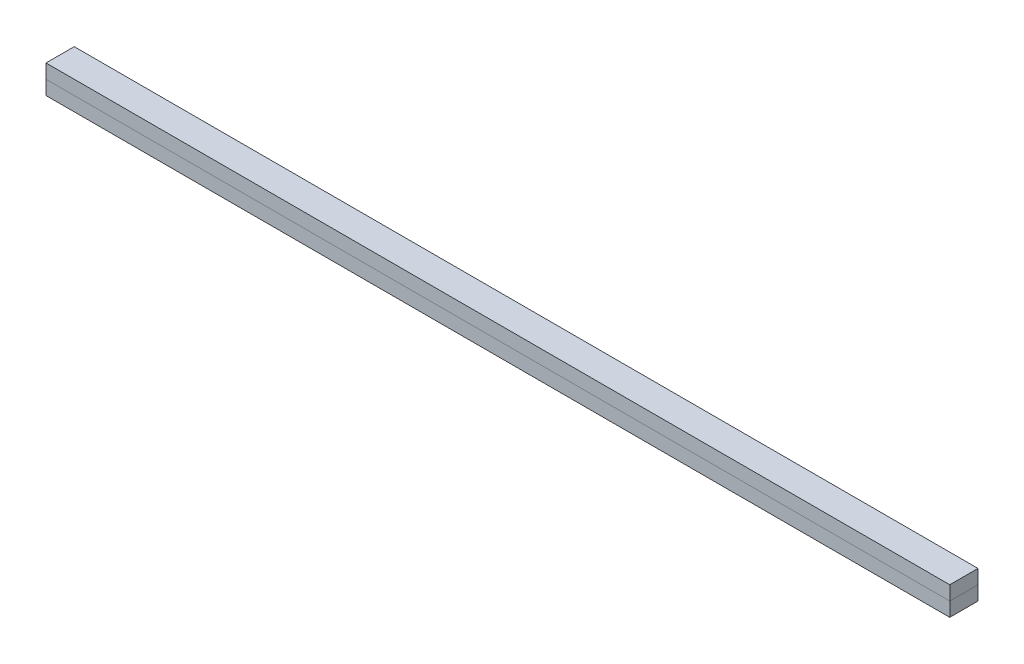
from build123d import *

# Parameters (mm, degrees)
SKETCH1_W      = 100
SKETCH1_H      = 50
EXTRUDE1_DEPTH = 3200


with BuildPart() as part:
    # Sketch1 → Extrude1 (new body)
    with BuildSketch(Plane(origin=(0, 0, 0), x_dir=(0, 0, -1), z_dir=(1, 0, 0))):
        with Locations((0, -25)):
            Rectangle(SKETCH1_W, SKETCH1_H)
    extrude1 = extrude(amount=-EXTRUDE1_DEPTH)

    # Mirror1: Extrude1 across plane
    add(extrude1.mirror(Plane.ZX))


solid = part.part
